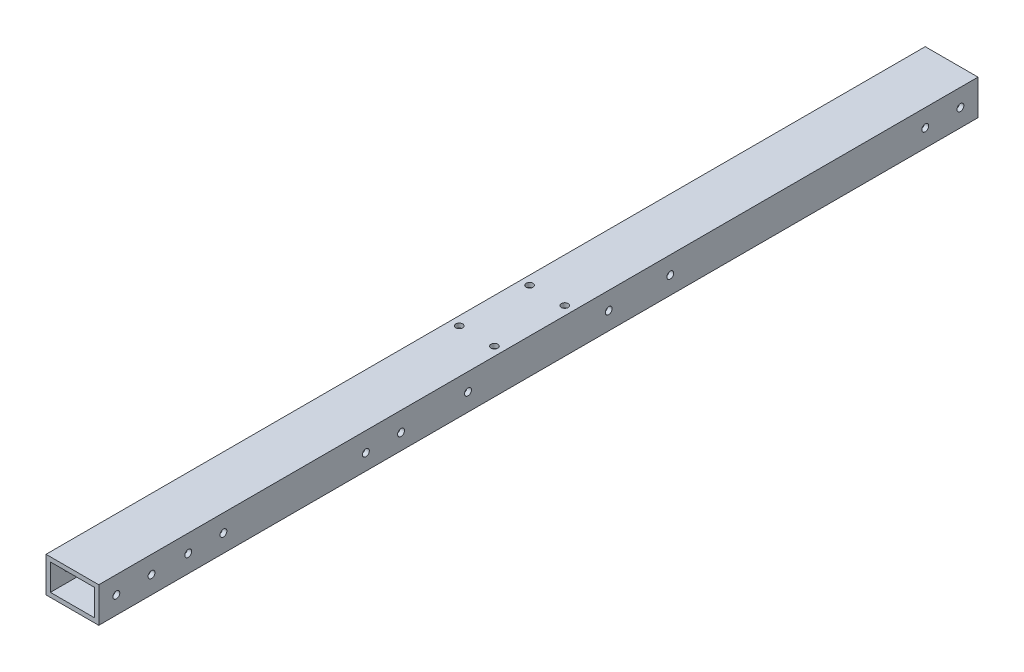
from build123d import *

# Parameters (mm, degrees)
BOSS_EXTRUDE1_DEPTH             = 317.499999
BOSS_EXTRUDE1_DEPTH_BACK        = 317.499999
SKETCH3_W                       = 38.1
SKETCH3_H                       = 25.4
SKETCH3_W_2                     = 31.75
SKETCH3_H_2                     = 19.05
F_10_CLEARANCE_HOLE2_D          = 4.9784
F_10_CLEARANCE_HOLE5_D          = 4.9784
F_10_CLEARANCE_HOLE4_D          = 4.9784
F_10_CLEARANCE_HOLE3_D          = 4.9784
F_10_CLEARANCE_HOLE6_AT_2_COUNT = 2
F_10_CLEARANCE_HOLE6_AT_2_PITCH = 25.4
F_10_CLEARANCE_HOLE6_AT_3_COUNT = 2
F_10_CLEARANCE_HOLE6_AT_3_PITCH = 50.8
F_10_CLEARANCE_HOLE6_AT_4_COUNT = 2
F_10_CLEARANCE_HOLE6_AT_4_PITCH = 56.796126628
F_10_CLEARANCE_HOLE7_D          = 4.9784


with BuildPart() as part:
    # Sketch3 → Boss-Extrude1 (new, two sides: drawn at the far end of the back side and taken through both)
    with BuildSketch(Plane.XY.offset(-BOSS_EXTRUDE1_DEPTH_BACK)):
        Rectangle(SKETCH3_W, SKETCH3_H)
        Rectangle(SKETCH3_W_2, SKETCH3_H_2, mode=Mode.SUBTRACT)
    extrude(amount=BOSS_EXTRUDE1_DEPTH + BOSS_EXTRUDE1_DEPTH_BACK)

    # #10 Clearance Hole2 (through all)
    with Locations(Plane.ZY.offset(19.05)):
        with Locations((-304.799999492, 0), (-279.399999492, 0), (279.400000508, 0), (304.800000508, 0)):
            Hole(F_10_CLEARANCE_HOLE2_D / 2)

    # #10 Clearance Hole5 (through all)
    with Locations(Plane(origin=(19.05, 0, 0), x_dir=(0, 0, -1), z_dir=(1, 0, 0))):
        with Locations((-124.587000508, -1.231595708), (-99.187000508, -1.231595708), (-252.857000508, -5.03e-07), (-227.457000508, -5.03e-07)):
            Hole(F_10_CLEARANCE_HOLE5_D / 2)

    # #10 Clearance Hole4 (through all)
    with Locations(Plane(origin=(19.05, 0, 0), x_dir=(0, 0, -1), z_dir=(1, 0, 0))):
        with Locations((-252.857000508, -5.03e-07), (-227.457000508, -5.03e-07)):
            Hole(F_10_CLEARANCE_HOLE4_D / 2)

    # #10 Clearance Hole3 (through all)
    with Locations(Plane.ZY.offset(19.05)):
        with Locations((-50.8, 0), (50.8, 0)):
            Hole(F_10_CLEARANCE_HOLE3_D / 2)

    # Sketch26 → #10 Clearance Hole6 (revolve, cut)
    with BuildSketch(Plane(origin=(12.7, 12.7, 25.4), x_dir=(0, 0, 1), z_dir=(1, 0, 0))):
        Polygon((0, 0), (0, 25.4), (5.2197, 25.4), (2.4892, 22.258919064), (2.4892, 0), align=None)
    f_10_clearance_hole6 = revolve(axis=Axis((12.7, 19.05, 25.4), (0, -1, 0)), mode=Mode.SUBTRACT)

    # #10 Clearance Hole6 at 2: #10 Clearance Hole6 ×2
    with Locations(*[(-i * F_10_CLEARANCE_HOLE6_AT_2_PITCH, 0, 0) for i in range(1, F_10_CLEARANCE_HOLE6_AT_2_COUNT)]):
        add(f_10_clearance_hole6, mode=Mode.SUBTRACT)

    # #10 Clearance Hole6 at 3: #10 Clearance Hole6 ×2
    with Locations(*[(0, 0, -i * F_10_CLEARANCE_HOLE6_AT_3_PITCH) for i in range(1, F_10_CLEARANCE_HOLE6_AT_3_COUNT)]):
        add(f_10_clearance_hole6, mode=Mode.SUBTRACT)

    # #10 Clearance Hole6 at 4: #10 Clearance Hole6 ×2
    with Locations(*[Vector(-0.447213595499958, 0, -0.894427190999916) * (i * F_10_CLEARANCE_HOLE6_AT_4_PITCH) for i in range(1, F_10_CLEARANCE_HOLE6_AT_4_COUNT)]):
        add(f_10_clearance_hole6, mode=Mode.SUBTRACT)

    # #10 Clearance Hole7 (through all)
    with Locations(Plane.ZY.offset(19.05)):
        with Locations((-95.25, 0)):
            Hole(F_10_CLEARANCE_HOLE7_D / 2)


solid = part.part
